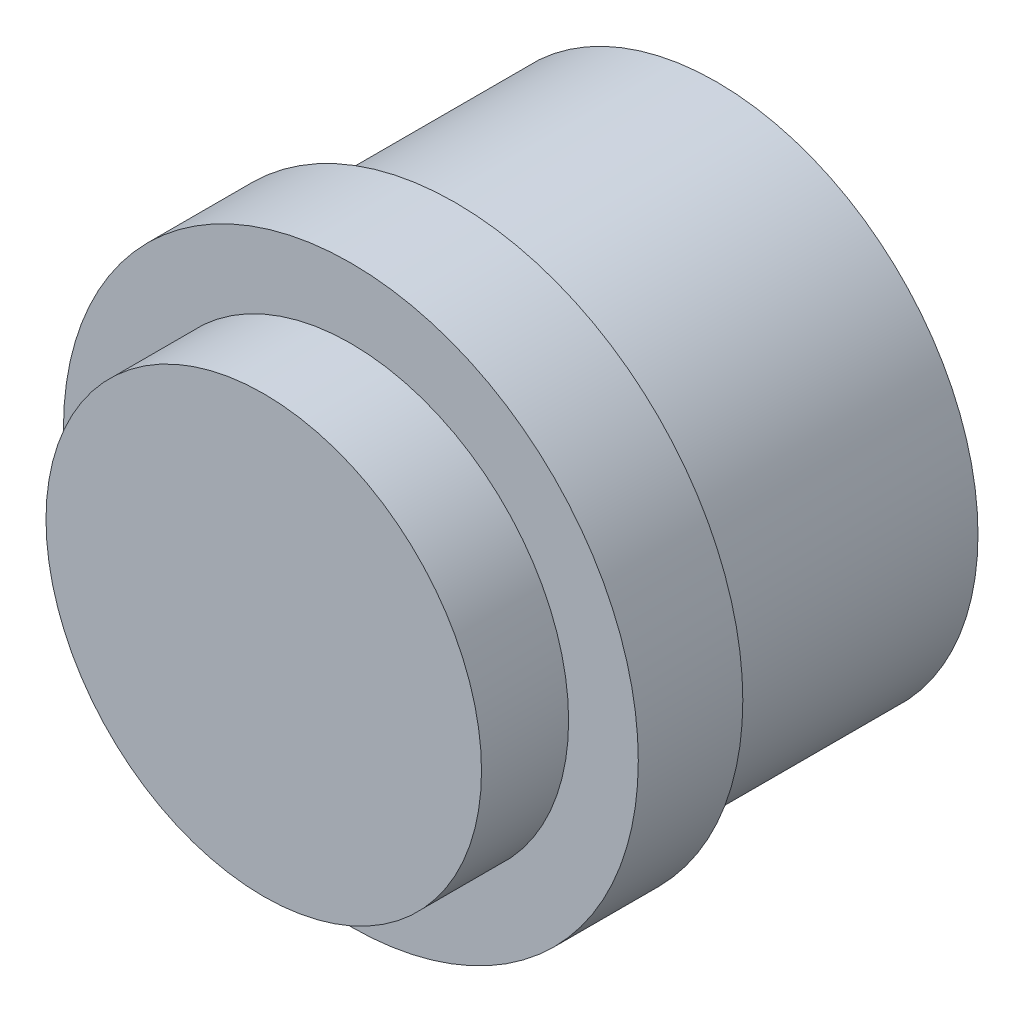
from build123d import *

# Parameters (mm, degrees)
SKETCH1_R           = 16.5
BOSS_EXTRUDE1_DEPTH = 26
CUT_EXTRUDE1_START  = -5
SKETCH2_R           = 16.5
SKETCH2_R_2         = 12.5
CUT_EXTRUDE1_DEPTH  = 5
SKETCH3_R           = 16.5
SKETCH3_R_2         = 15
CUT_EXTRUDE2_DEPTH  = 15
SKETCH4_R           = 12.5
CUT_EXTRUDE3_DEPTH  = 15


with BuildPart() as part:
    # Sketch1 → Boss-Extrude1 (new body)
    with BuildSketch(Plane(origin=(0, 0, 0), x_dir=(0, 1, 0), z_dir=(0, 0, 1))):
        with Locations(Location((0, 0, 0), (0, 0, 90))):
            Circle(SKETCH1_R)
    extrude(amount=BOSS_EXTRUDE1_DEPTH)

    # Sketch2 → Cut-Extrude1 (cut)
    with BuildSketch(Plane.XY.offset(26).offset(CUT_EXTRUDE1_START)):
        with Locations(Location((0, 0, 0), (0, 0, 180))):
            Circle(SKETCH2_R)
        Circle(SKETCH2_R_2, mode=Mode.SUBTRACT)
    extrude(amount=CUT_EXTRUDE1_DEPTH, mode=Mode.SUBTRACT)

    # Sketch3 → Cut-Extrude2 (cut)
    with BuildSketch(Plane(origin=(0, 0, 0), x_dir=(1, 0, 0), z_dir=(0, 0, -1))):
        with Locations(Location((0, 0, 0), (0, 0, 180))):
            Circle(SKETCH3_R)
        with Locations(Location((0, 0, 0), (0, 0, 180))):
            Circle(SKETCH3_R_2, mode=Mode.SUBTRACT)
    extrude(amount=-CUT_EXTRUDE2_DEPTH, mode=Mode.SUBTRACT)

    # Sketch4 → Cut-Extrude3 (cut)
    with BuildSketch(Plane(origin=(0, 0, 0), x_dir=(1, 0, 0), z_dir=(0, 0, -1))):
        Circle(SKETCH4_R)
    extrude(amount=-CUT_EXTRUDE3_DEPTH, mode=Mode.SUBTRACT)


solid = part.part
